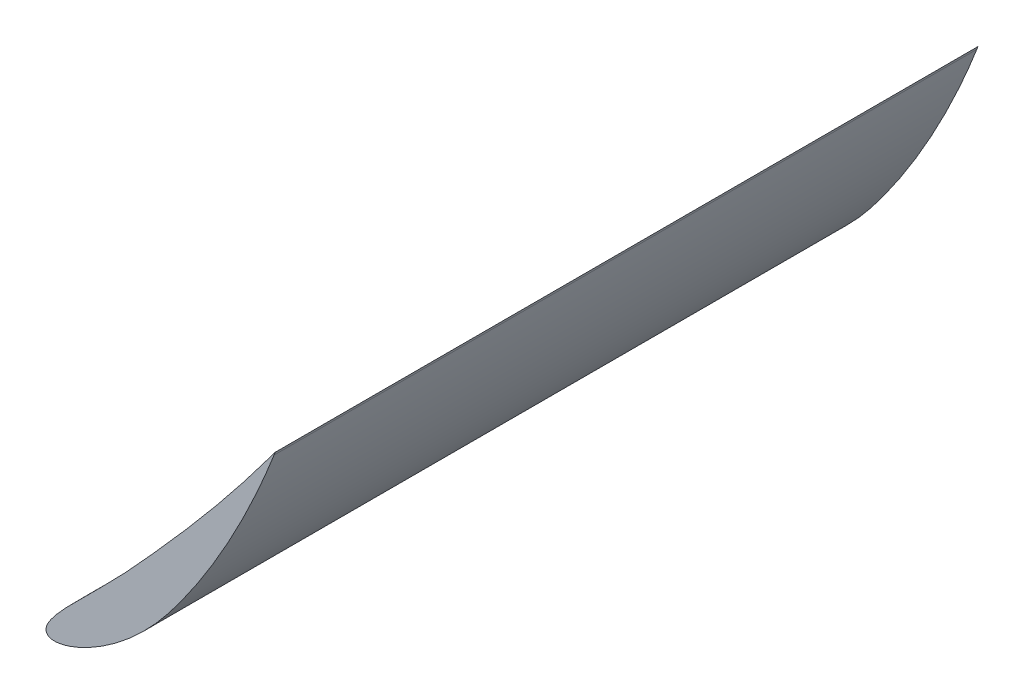
from build123d import *

# Parameters (mm, degrees)
BOSS_EXTRUDE1_DEPTH = 254


with BuildPart() as part:
    # Sketch1 → Boss-Extrude1 (new body)
    with BuildSketch(Plane.XY):
        with BuildLine():
            Line((81.511444345, 97.390502859), (82.192739914, 98.308581554))
            Line((82.192739914, 98.308581554), (81.756608516, 97.184785693))
            add(Edge.make_bspline(
                [(81.756608516, 97.184785693), (81.7316792, 97.120549407), (81.632132094, 96.864042707), (81.407728169, 96.289171862), (81.033364945, 95.336716476), (80.507503011, 94.015604068), (79.829046021, 92.337613031), (78.996516853, 90.317819192), (78.008599211, 87.973973912), (76.864331348, 85.326520379), (75.563174618, 82.39805106), (74.104950584, 79.213406752), (72.491153275, 75.798643231), (70.723434587, 72.181630378), (68.804632505, 68.391355066), (66.739420351, 64.457353705), (64.53292164, 60.410126963), (62.192043894, 56.280367272), (59.724417975, 52.099067648), (57.139117435, 47.897266554), (54.447104012, 43.705001834), (51.659263969, 39.552845289), (48.789366546, 35.46928923), (45.849089841, 31.48469842), (42.863736697, 27.617649803), (39.779157596, 23.949002752), (36.622650342, 20.498375873), (33.418257647, 17.283094467), (30.193205578, 14.316986172), (26.976711981, 11.610483674), (23.799330275, 9.171404815), (20.693176479, 7.004043577), (17.690445546, 5.110776501), (14.82369285, 3.490992148), (12.124631562, 2.142346626), (9.623196915, 1.061312858), (7.347446905, 0.242219484), (5.321498885, -0.32005744), (3.565123614, -0.632851232), (2.08995471, -0.700909761), (0.896547455, -0.525082578), (-0.013401143, -0.081804136), (-0.579008282, 0.660655586), (-0.68861093, 1.632061937), (-0.413303285, 2.742883288), (0.196818824, 4.028541279), (1.137954116, 5.503123048), (2.400612688, 7.170375486), (3.971801237, 9.029076404), (5.833978608, 11.076265304), (7.966452508, 13.308114525), (10.344710675, 15.720915973), (12.942739442, 18.309610481), (15.731420305, 21.06951334), (18.680606539, 23.99459195), (21.758461338, 27.078400751), (24.932967555, 30.312956499), (28.171651177, 33.689144273), (31.44370548, 37.195619401), (34.715133181, 40.822905715), (38.026882626, 44.494241162), (41.344254262, 48.200989973), (44.645184927, 51.921549282), (47.904878915, 55.636785789), (51.101629595, 59.325019699), (54.214433494, 62.964747578), (57.224003935, 66.533442429), (60.113297002, 70.00792398), (62.865902949, 73.365523414), (65.46804394, 76.582875359), (67.906618257, 79.637639427), (70.17031171, 82.507877476), (72.248475631, 85.173105701), (74.132535455, 87.613424091), (75.813982201, 89.811085714), (77.286005583, 91.749677425), (78.542016882, 93.415033532), (79.577045247, 94.794663223), (80.38666345, 95.878355721), (80.967324011, 96.658293954), (81.316927502, 97.128382016), (81.472499349, 97.338022595), (81.511444345, 97.390502859)],
                knots=[0, 0, 0, 0, 0.000791305, 0.003159821, 0.007087067, 0.012544017, 0.019489361, 0.027872822, 0.037632601, 0.048699423, 0.060994432, 0.074433103, 0.088923206, 0.104367786, 0.120665388, 0.137709591, 0.15539151, 0.173600813, 0.192223028, 0.211145779, 0.230254002, 0.249435263, 0.268576885, 0.287568118, 0.306301322, 0.324670996, 0.34259499, 0.35999234, 0.376785861, 0.392898379, 0.408252229, 0.422771246, 0.436380025, 0.44900307, 0.460569968, 0.471014387, 0.480280085, 0.488325188, 0.49513273, 0.500728157, 0.50521737, 0.508862648, 0.512070109, 0.515470595, 0.519696371, 0.525078124, 0.531750336, 0.539754064, 0.549080127, 0.559691732, 0.571531153, 0.584527708, 0.598597801, 0.613649926, 0.62958577, 0.646300272, 0.663685555, 0.681632124, 0.700026867, 0.718761006, 0.737726751, 0.75680858, 0.775887894, 0.794846492, 0.813569043, 0.831939507, 0.849846884, 0.867180215, 0.883834326, 0.899707217, 0.914700572, 0.928722615, 0.941687172, 0.953513138, 0.964128061, 0.973465194, 0.981467029, 0.988082829, 0.993272151, 0.997001957, 0.999249486, 1, 1, 1, 1], degree=3))
        make_face()
    extrude(amount=BOSS_EXTRUDE1_DEPTH)


solid = part.part
